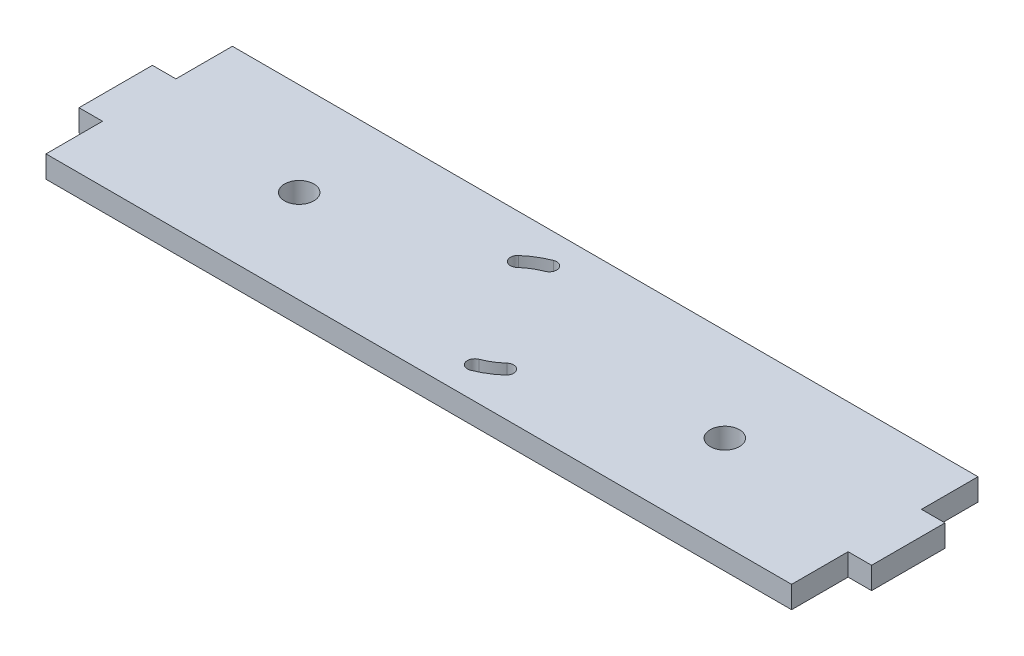
from build123d import *

# Parameters (mm, degrees)
BOSS_EXTRUDE1_DEPTH = 3
CUT_EXTRUDE1_DEPTH  = 56.554387766
SKETCH3_R           = 2
CUT_EXTRUDE2_DEPTH  = 56.554387766


with BuildPart() as part:
    # Sketch1 → Boss-Extrude1 (new body)
    with BuildSketch(Plane(origin=(0, 0, 0), x_dir=(1, 0, 0), z_dir=(0, 1, 0))):
        Polygon((-50.8, -5), (-50.8, -12.7), (50.8, -12.7), (50.8, -5), (54, -5), (54, 5), (50.8, 5), (50.8, 12.7), (-50.8, 12.7), (-50.8, 5), (-54, 5), (-54, -5), align=None)
    extrude(amount=BOSS_EXTRUDE1_DEPTH)

    # Sketch2 → Cut-Extrude1 (cut, through all)
    with BuildSketch(Plane(origin=(0, 3, 0), x_dir=(1, 0, 0), z_dir=(0, 1, 0))):
        with BuildLine():
            ThreePointArc((2.927112115, -7.445267938), (4.175733356, -6.823727057), (5.297427434, -5.994769602))
            ThreePointArc((5.297427434, -5.994769602), (6.708952064, -6.081937373), (6.621784293, -7.493462002))
            ThreePointArc((6.621784293, -7.493462002), (5.219666694, -8.529658821), (3.658890144, -9.306584922))
            ThreePointArc((3.658890144, -9.306584922), (2.362342638, -8.741815444), (2.927112115, -7.445267938))
        make_face()
        with BuildLine():
            ThreePointArc((-3.658890144, 9.306584922), (-5.219666694, 8.529658821), (-6.621784293, 7.493462002))
            ThreePointArc((-6.621784293, 7.493462002), (-6.708952064, 6.081937373), (-5.297427434, 5.994769602))
            ThreePointArc((-5.297427434, 5.994769602), (-4.175733356, 6.823727057), (-2.927112115, 7.445267938))
            ThreePointArc((-2.927112115, 7.445267938), (-2.362342638, 8.741815444), (-3.658890144, 9.306584922))
        make_face()
    extrude(amount=-CUT_EXTRUDE1_DEPTH, mode=Mode.SUBTRACT)

    # Sketch3 → Cut-Extrude2 (cut, through all)
    with BuildSketch(Plane(origin=(0, 3, 0), x_dir=(1, 0, 0), z_dir=(0, 1, 0))):
        with Locations(Location((29, 0, 0), (0, 0, 270))):
            Circle(SKETCH3_R)
        with Locations(Location((-29, 0, 0), (0, 0, 270))):
            Circle(SKETCH3_R)
    extrude(amount=-CUT_EXTRUDE2_DEPTH, mode=Mode.SUBTRACT)


solid = part.part
